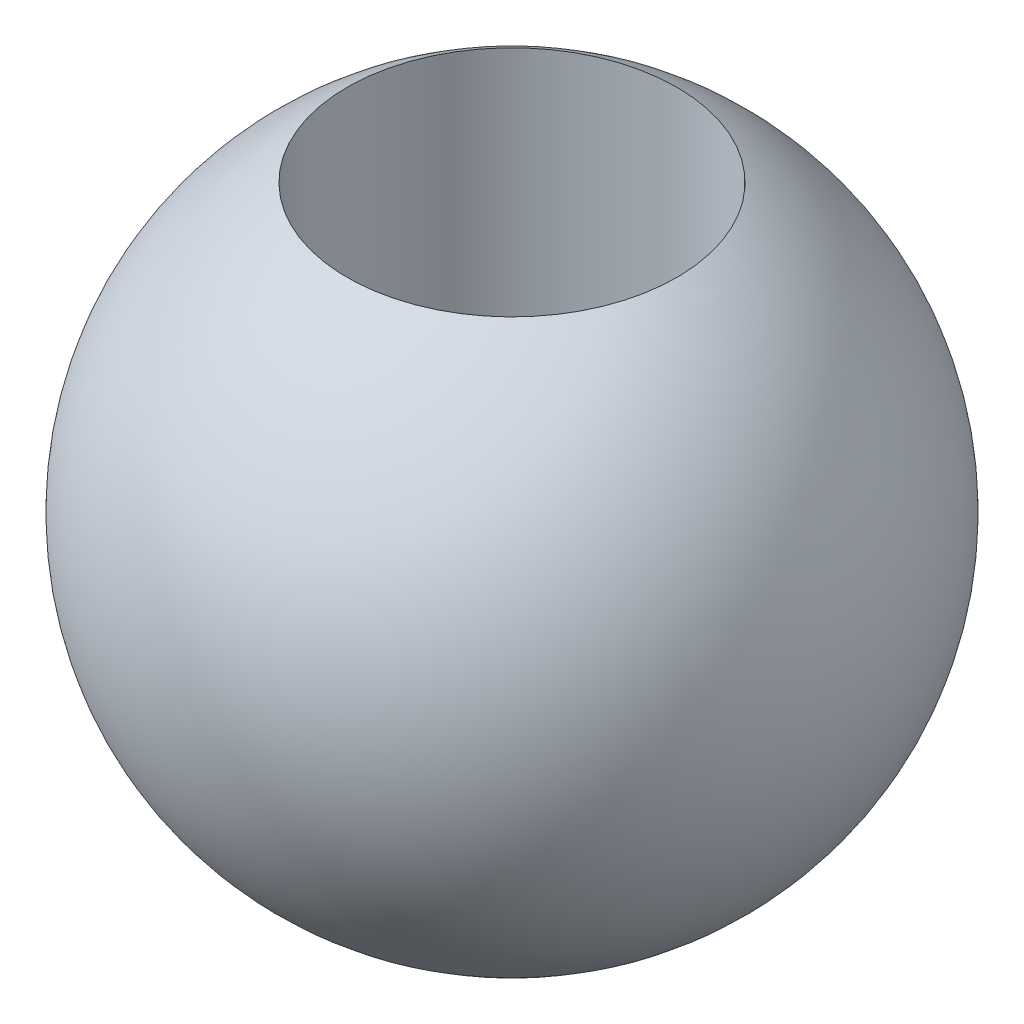
from build123d import *

# Parameters (mm, degrees)
CUT_EXTRUDE1_REACH                  = 15.856
CUT_EXTRUDE1_END_RADIUS             = 8
SKETCH2_R                           = 4
CUT_EXTRUDE1_DIRECTION_2_REACH      = 15.856
CUT_EXTRUDE1_DIRECTION_2_END_RADIUS = 8


with BuildPart() as part:
    # Sketch1 → Revolve1 (revolve)
    with BuildSketch(Plane(origin=(0, 0, 0), x_dir=(-1, 0, 0), z_dir=(0, 1, 0))):
        with BuildLine():
            Line((-8, 0), (8, 0))
            ThreePointArc((8, 0), (0, 8), (-8, 0))
        make_face()
    revolve(axis=Axis((8, 0, 0), (-1, 0, 0)))

    # Cut-Extrude1: up to this sphere (the profile starts inside it)
    cut_extrude1_end = Location((0, 0, 0)) * Sphere(CUT_EXTRUDE1_END_RADIUS, mode=Mode.PRIVATE)
    # Sketch2 → Cut-Extrude1 (cut, up to the surface)
    with BuildSketch(Plane(origin=(0, 0, 0), x_dir=(-1, 0, 0), z_dir=(0, 1, 0)), mode=Mode.PRIVATE) as cut_extrude1_sk1:
        with Locations(Location((0, 0, 0), (0, 0, 270))):
            Circle(SKETCH2_R)
    cut_extrude1_tool1 = extrude(cut_extrude1_sk1.sketch, amount=-CUT_EXTRUDE1_REACH, mode=Mode.PRIVATE) & cut_extrude1_end
    add(cut_extrude1_tool1.solids().sort_by_distance((0, 0, 0))[0], mode=Mode.SUBTRACT)

    # Cut-Extrude1 direction 2: up to this sphere (the profile starts inside it)
    cut_extrude1_direction_2_end = Location((0, 0, 0)) * Sphere(CUT_EXTRUDE1_DIRECTION_2_END_RADIUS, mode=Mode.PRIVATE)
    # Sketch2 → Cut-Extrude1 direction 2 (cut, up to the surface)
    with BuildSketch(Plane(origin=(0, 0, 0), x_dir=(-1, 0, 0), z_dir=(0, 1, 0)), mode=Mode.PRIVATE) as cut_extrude1_direction_2_sk1:
        with Locations(Location((0, 0, 0), (0, 0, 270))):
            Circle(SKETCH2_R)
    cut_extrude1_direction_2_tool1 = extrude(cut_extrude1_direction_2_sk1.sketch, amount=CUT_EXTRUDE1_DIRECTION_2_REACH, mode=Mode.PRIVATE) & cut_extrude1_direction_2_end
    add(cut_extrude1_direction_2_tool1.solids().sort_by_distance((0, 0, 0))[0], mode=Mode.SUBTRACT)


solid = part.part
